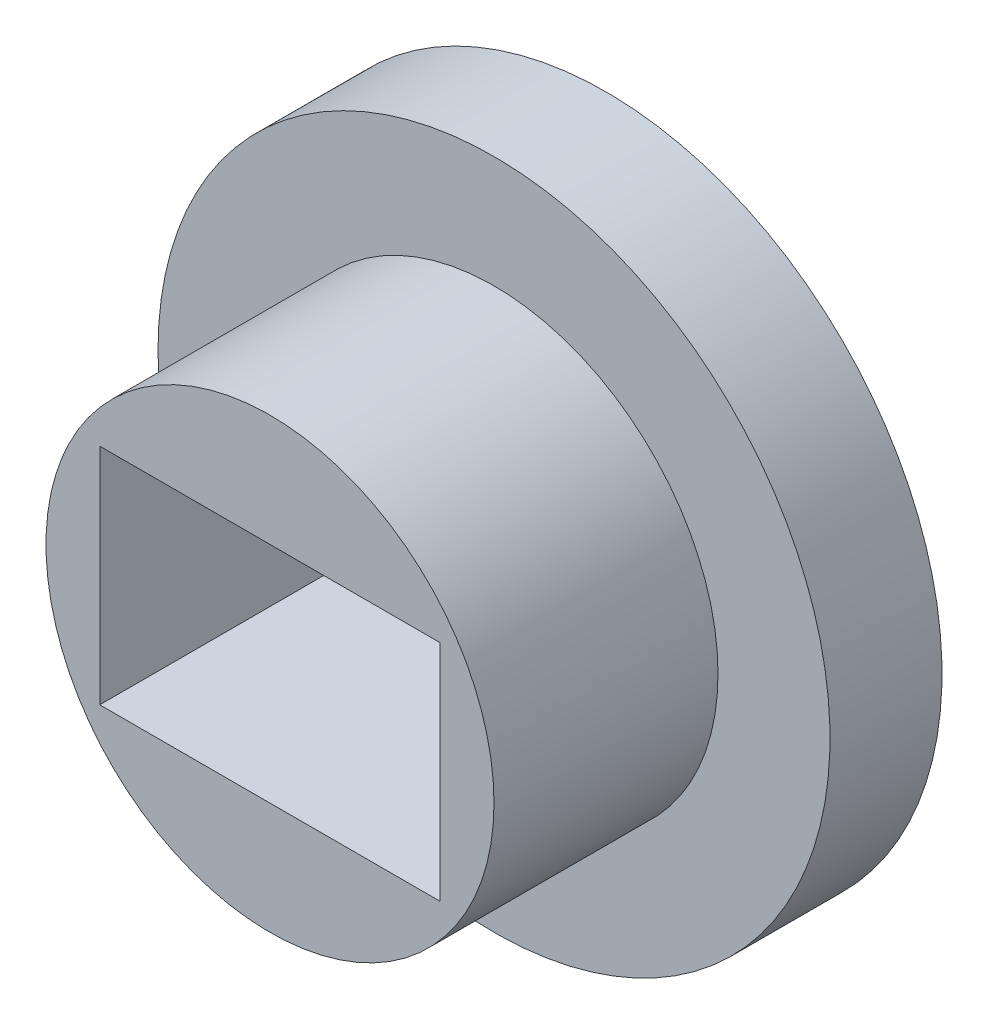
from build123d import *

# Parameters (mm, degrees)
SKETCH1_R           = 6.35
BOSS_EXTRUDE1_DEPTH = 6.35
SKETCH3_R           = 9.525
BOSS_EXTRUDE2_DEPTH = 3.175
SKETCH4_W           = 9.652
SKETCH4_H           = 6.35
CUT_EXTRUDE2_DEPTH  = 17.497783942


with BuildPart() as part:
    # Sketch1 → Boss-Extrude1 (new body)
    with BuildSketch(Plane.XY):
        Circle(SKETCH1_R)
    extrude(amount=BOSS_EXTRUDE1_DEPTH)

    # Sketch3 → Boss-Extrude2 (add)
    with BuildSketch(Plane(origin=(0, 0, 0), x_dir=(-1, 0, 0), z_dir=(0, 0, -1))):
        Circle(SKETCH3_R)
    extrude(amount=BOSS_EXTRUDE2_DEPTH)

    # Sketch4 → Cut-Extrude2 (cut, through all)
    with BuildSketch(Plane(origin=(0, 0, -3.175), x_dir=(-1, 0, 0), z_dir=(0, 0, -1))):
        Rectangle(SKETCH4_W, SKETCH4_H)
    extrude(amount=-CUT_EXTRUDE2_DEPTH, mode=Mode.SUBTRACT)


solid = part.part
